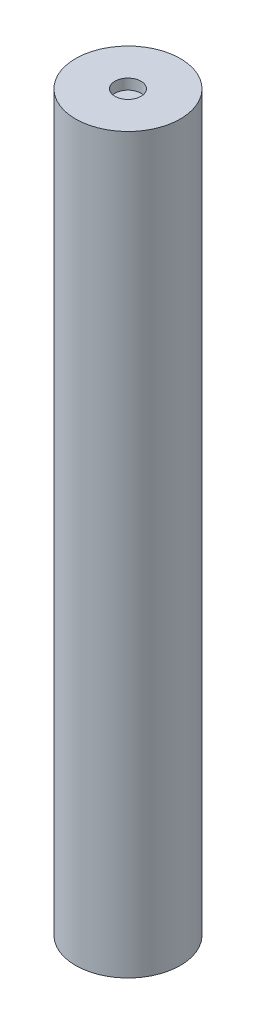
from build123d import *

# Parameters (mm, degrees)
SKETCH1_R           = 12.7
BOSS_EXTRUDE1_DEPTH = 177.8
SKETCH2_R           = 3.175
CUT_EXTRUDE1_DEPTH  = 2.54
CUT_EXTRUDE2_START  = -2.54
SKETCH3_R           = 3.175
CUT_EXTRUDE2_DEPTH  = 2.54


with BuildPart() as part:
    # Sketch1 → Boss-Extrude1 (new body)
    with BuildSketch(Plane(origin=(0, 0, 0), x_dir=(1, 0, 0), z_dir=(0, 1, 0))):
        with Locations(Location((0, 0, 0), (0, 0, 270))):
            Circle(SKETCH1_R)
    extrude(amount=BOSS_EXTRUDE1_DEPTH)

    # Sketch2 → Cut-Extrude1 (cut)
    with BuildSketch(Plane(origin=(0, 177.8, 0), x_dir=(1, 0, 0), z_dir=(0, 1, 0))):
        with Locations(Location((0, 0, 0), (0, 0, 270))):
            Circle(SKETCH2_R)
    extrude(amount=-CUT_EXTRUDE1_DEPTH, mode=Mode.SUBTRACT)

    # Sketch3 → Cut-Extrude2 (cut)
    with BuildSketch(Plane.XZ.offset(CUT_EXTRUDE2_START)):
        with Locations(Location((0, 0, 0), (0, 0, 90))):
            Circle(SKETCH3_R)
    extrude(amount=CUT_EXTRUDE2_DEPTH, mode=Mode.SUBTRACT)


solid = part.part
